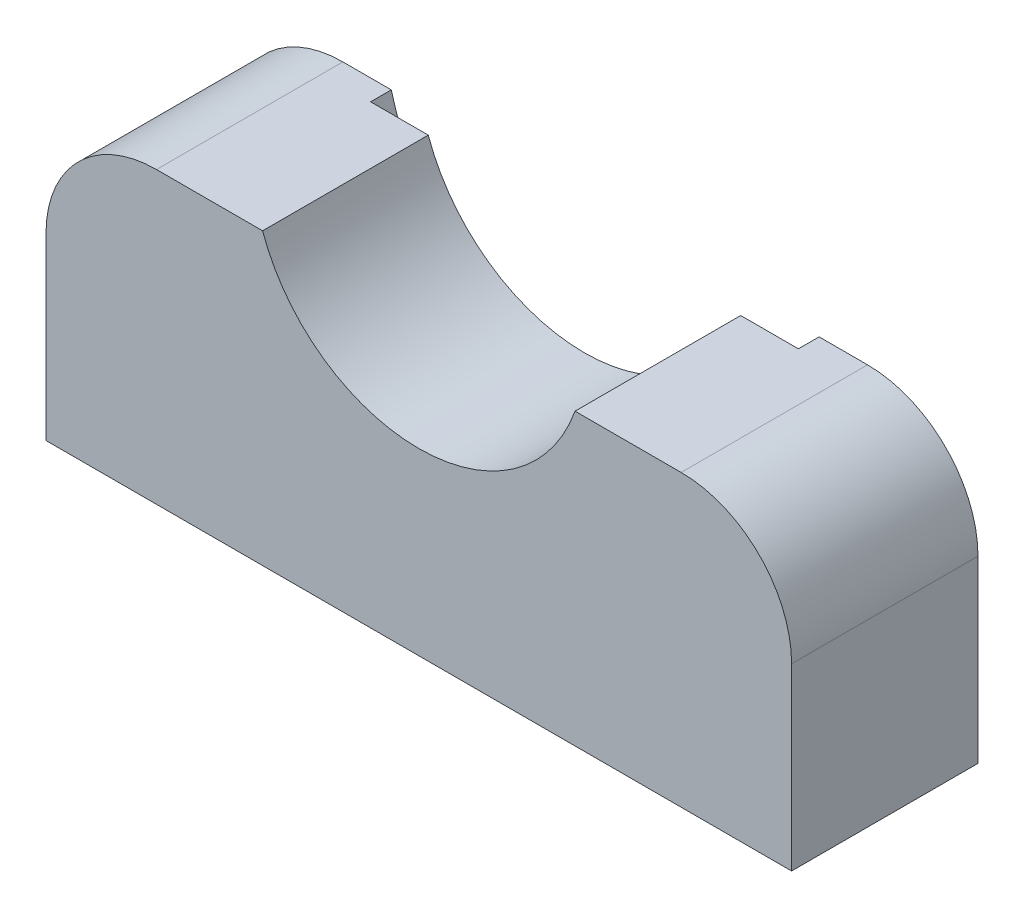
from build123d import *

# Parameters (mm, degrees)
BOSS_EXTRUDE1_DEPTH = 6.75
SKETCH3_R           = 8
CUT_EXTRUDE2_DEPTH  = 0.75
SKETCH4_W           = 27
SKETCH4_H           = 2
CUT_EXTRUDE3_DEPTH  = 9
FILLET1_R           = 4


with BuildPart() as part:
    # Sketch1 → Boss-Extrude1 (new body)
    with BuildSketch(Plane.XY):
        with BuildLine():
            Line((-27, 0), (0, 0))
            Line((0, 0), (0, 12.5))
            Line((0, 12.5), (-7.5, 12.5))
            ThreePointArc((-7.5, 12.5), (-13.5, 6.5), (-19.5, 12.5))
            Line((-19.5, 12.5), (-27, 12.5))
            Line((-27, 12.5), (-27, 0))
        make_face()
    extrude(amount=BOSS_EXTRUDE1_DEPTH)

    # Sketch3 → Cut-Extrude2 (cut)
    with BuildSketch(Plane(origin=(0, 0, 0), x_dir=(-1, 0, 0), z_dir=(0, 0, -1))):
        with Locations((13.5, 12.5)):
            Circle(SKETCH3_R)
    extrude(amount=-CUT_EXTRUDE2_DEPTH, mode=Mode.SUBTRACT)

    # Sketch4 → Cut-Extrude3 (cut)
    with BuildSketch(Plane.XY.offset(6.75)):
        with Locations((-13.5, 11.5)):
            Rectangle(SKETCH4_W, SKETCH4_H)
    extrude(amount=-CUT_EXTRUDE3_DEPTH, mode=Mode.SUBTRACT)

    # Fillet1
    fillet1_edges = [part.edges().sort_by_distance(p)[0] for p in [
        (-27, 10.5, 3.375),
        (0, 10.5, 3.375),
    ]]
    fillet(fillet1_edges, radius=FILLET1_R)


solid = part.part
